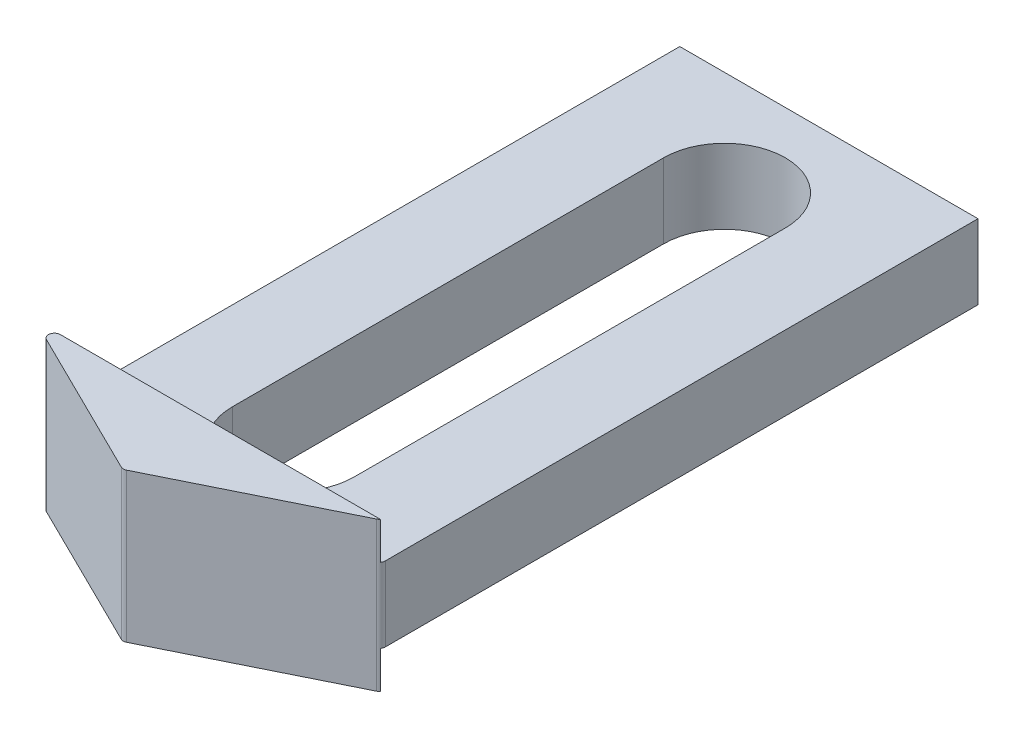
from build123d import *

# Parameters (mm, degrees)
BOSS_EXTRUDE1_DEPTH     = 3.175
FILLET1_R               = 0.254
CUT_EXTRUDE1_REACH      = 32.259
CUT_EXTRUDE2_DEPTH      = 29.575
CUT_EXTRUDE2_DEPTH_BACK = 29.575
SKETCH6_W               = 25.4
SKETCH6_H               = 1.5875


with BuildPart() as part:
    # Sketch1 → Boss-Extrude1 (new, symmetric)
    with BuildSketch(Plane(origin=(0, 0, 0), x_dir=(1, 0, 0), z_dir=(0, 1, 0))):
        Polygon((15.169114158, 0), (7.786246133, -3.645659373), (0.403378108, 0), (2.469114158, 0), (2.469114158, 25.4), (15.169114158, 25.4), align=None)
    extrude(amount=BOSS_EXTRUDE1_DEPTH, both=True)

    # Fillet1
    fillet1_edges = [part.edges().sort_by_distance(p)[0] for p in [
        (2.469114158, 0, 0),
        (15.169114158, 0, 0),
        (7.786246133, 0, 3.645659373),
        (0.403378108, 0, 0),
    ]]
    fillet(fillet1_edges, radius=FILLET1_R)

    # Sketch5 → Cut-Extrude1 (cut, up to next)
    with BuildSketch(Plane(origin=(0, 3.175, 0), x_dir=(1, 0, 0), z_dir=(0, 1, 0)), mode=Mode.PRIVATE) as cut_extrude1_sk1:
        with BuildLine():
            Line((11.409914158, 20.955), (11.409914158, 2.5908))
            ThreePointArc((11.409914158, 2.5908), (8.819114158, 0), (6.228314158, 2.5908))
            Line((6.228314158, 2.5908), (6.228314158, 20.955))
            ThreePointArc((6.228314158, 20.955), (8.819114158, 23.5458), (11.409914158, 20.955))
        make_face()
    cut_extrude1_tool1 = extrude(cut_extrude1_sk1.sketch, amount=-CUT_EXTRUDE1_REACH, mode=Mode.PRIVATE) & part.part
    add(cut_extrude1_tool1.solids().sort_by_distance((8.819114, 3.175, -11.7729))[0], mode=Mode.SUBTRACT)

    # Sketch6 → Cut-Extrude2 (cut, two sides: drawn at the far end of the back side and taken through both)
    with BuildSketch(Plane.ZY.offset(-2.469114158).offset(-CUT_EXTRUDE2_DEPTH_BACK)):
        with Locations((-12.7, 2.38125)):
            Rectangle(SKETCH6_W, SKETCH6_H)
        with Locations((-12.7, -2.38125)):
            Rectangle(SKETCH6_W, SKETCH6_H)
    extrude(amount=CUT_EXTRUDE2_DEPTH + CUT_EXTRUDE2_DEPTH_BACK, mode=Mode.SUBTRACT)


solid = part.part
